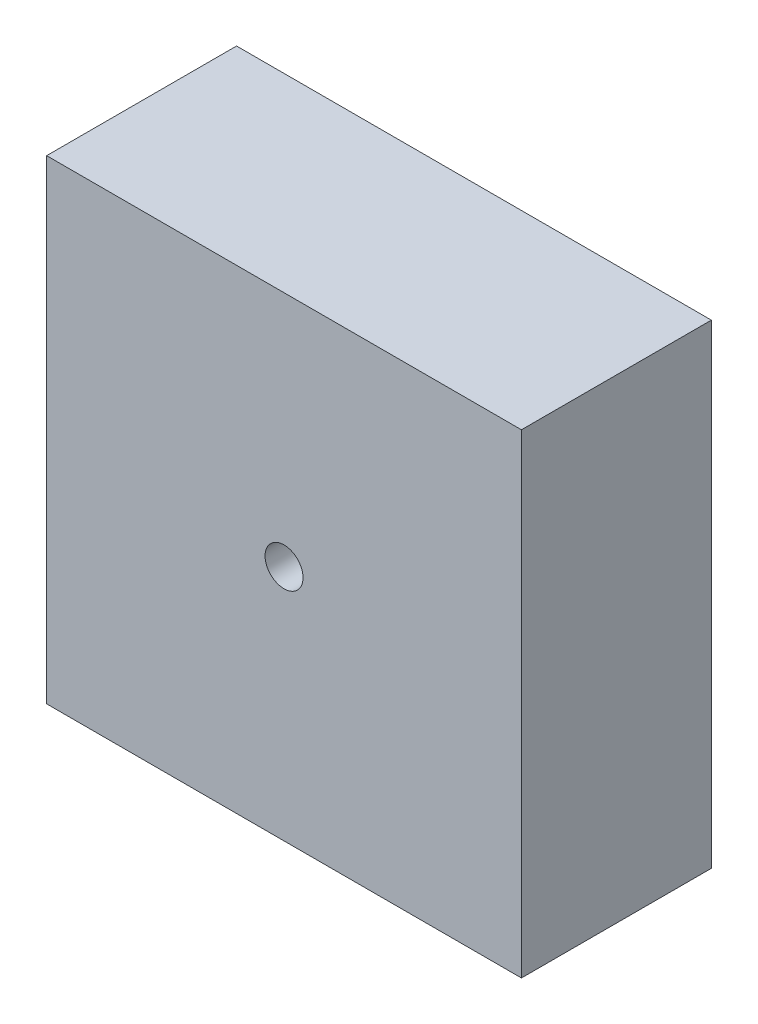
from build123d import *

# Parameters (mm, degrees)
SKETCH1_W           = 50
SKETCH1_H           = 50
SKETCH1_R           = 2
BOSS_EXTRUDE1_DEPTH = 20


with BuildPart() as part:
    # Sketch1 → Boss-Extrude1 (new body)
    with BuildSketch(Plane.XY):
        Rectangle(SKETCH1_W, SKETCH1_H)
        Circle(SKETCH1_R, mode=Mode.SUBTRACT)
    extrude(amount=BOSS_EXTRUDE1_DEPTH)


solid = part.part
